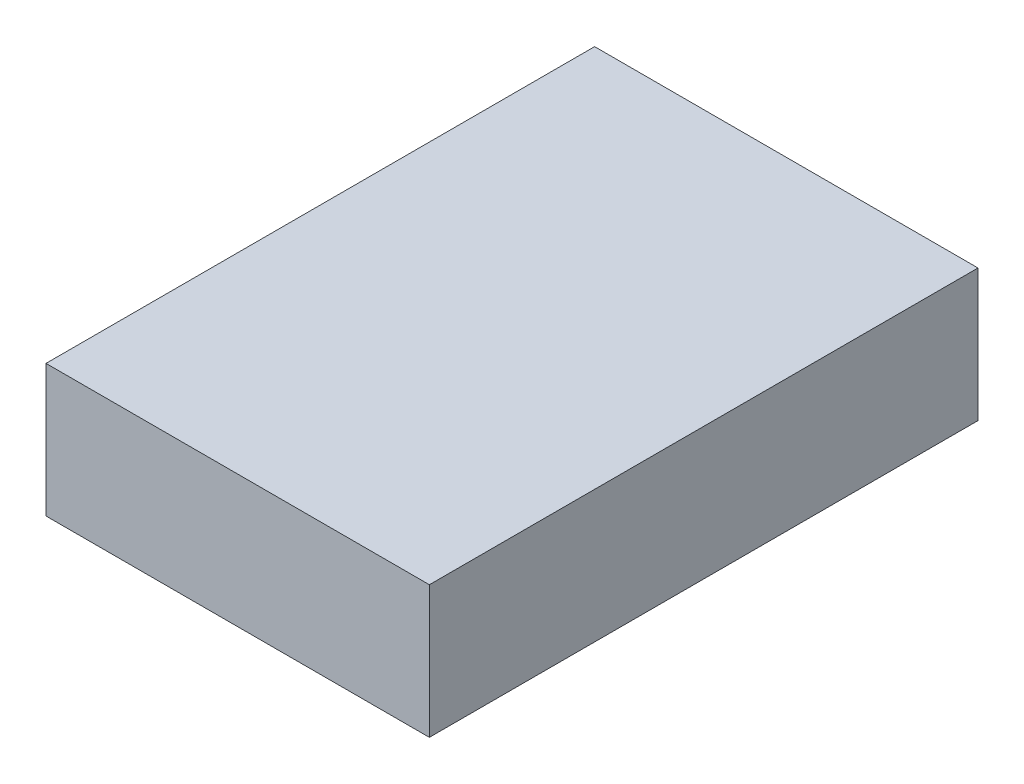
from build123d import *

# Parameters (mm, degrees)
SKETCH1_W           = 58
SKETCH1_H           = 83
BOSS_EXTRUDE1_DEPTH = 20


with BuildPart() as part:
    # Sketch1 → Boss-Extrude1 (new body)
    with BuildSketch(Plane(origin=(0, 0, 0), x_dir=(1, 0, 0), z_dir=(0, 1, 0))):
        with Locations((-4.373368146, -26.221932115)):
            Rectangle(SKETCH1_W, SKETCH1_H)
    extrude(amount=BOSS_EXTRUDE1_DEPTH)


solid = part.part
